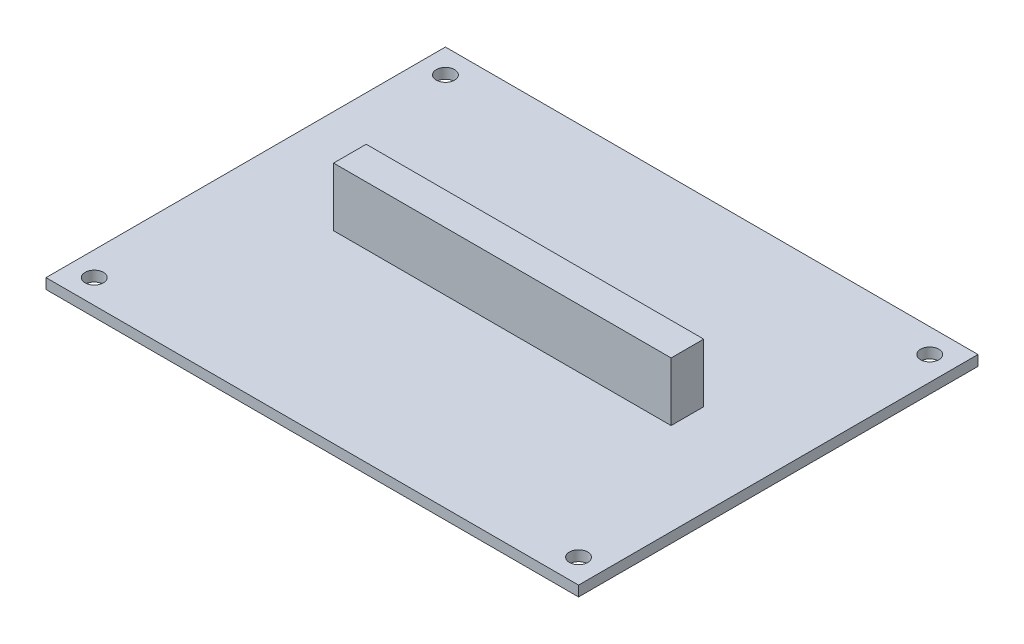
from build123d import *

# Parameters (mm, degrees)
SKETCH1_W           = 80
SKETCH1_H           = 60
SKETCH1_R           = 1.375
BOSS_EXTRUDE1_DEPTH = 1.55
SKETCH2_W           = 50.7
SKETCH2_H           = 4.9
BOSS_EXTRUDE2_DEPTH = 8.8


with BuildPart() as part:
    # Sketch1 → Boss-Extrude1 (new body)
    with BuildSketch(Plane(origin=(0, 0, 0), x_dir=(1, 0, 0), z_dir=(0, 1, 0))):
        Rectangle(SKETCH1_W, SKETCH1_H)
        with Locations(Location((-36.375, 26.375, 0), (0, 0, 90))):
            Circle(SKETCH1_R, mode=Mode.SUBTRACT)
        with Locations(Location((-36.375, -26.375, 0), (0, 0, 90))):
            Circle(SKETCH1_R, mode=Mode.SUBTRACT)
        with Locations(Location((36.375, -26.375, 0), (0, 0, 90))):
            Circle(SKETCH1_R, mode=Mode.SUBTRACT)
        with Locations(Location((36.375, 26.375, 0), (0, 0, 90))):
            Circle(SKETCH1_R, mode=Mode.SUBTRACT)
    extrude(amount=BOSS_EXTRUDE1_DEPTH)

    # Sketch2 → Boss-Extrude2 (add)
    with BuildSketch(Plane(origin=(0, 1.55, 0), x_dir=(1, 0, 0), z_dir=(0, 1, 0))):
        with Locations((0.85, 0.15)):
            Rectangle(SKETCH2_W, SKETCH2_H)
    extrude(amount=BOSS_EXTRUDE2_DEPTH)


solid = part.part
